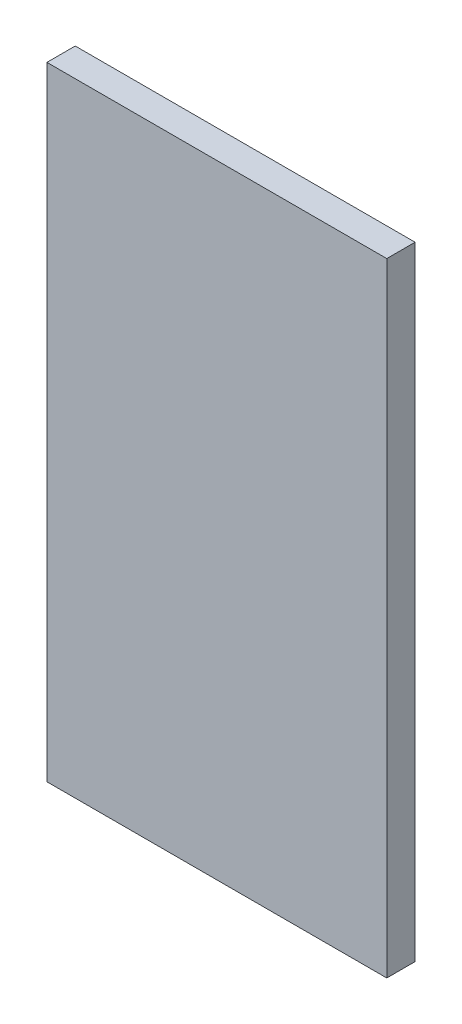
from build123d import *

# Parameters (mm, degrees)
SKETCH1_W           = 60
SKETCH1_H           = 5
BOSS_EXTRUDE1_DEPTH = 110


with BuildPart() as part:
    # Sketch1 → Boss-Extrude1 (new body)
    with BuildSketch(Plane(origin=(0, 0, 0), x_dir=(1, 0, 0), z_dir=(0, 1, 0))):
        with Locations((30, -2.5)):
            Rectangle(SKETCH1_W, SKETCH1_H)
    extrude(amount=BOSS_EXTRUDE1_DEPTH)


solid = part.part
